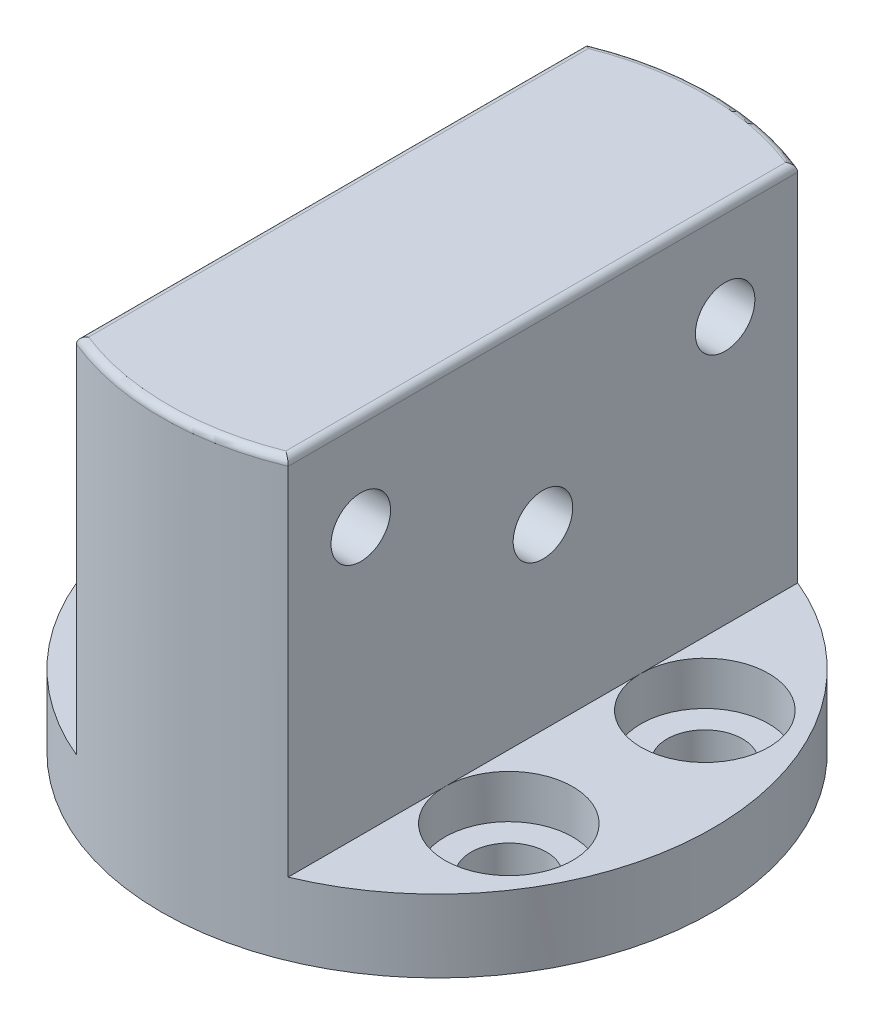
from build123d import *

# Parameters (mm, degrees)
SKETCH1_R           = 19
SKETCH1_R_2         = 2.6
BOSS_EXTRUDE1_DEPTH = 5
SKETCH2_R           = 4.4
CUT_EXTRUDE1_DEPTH  = 3
BOSS_EXTRUDE2_DEPTH = 25
FILLET1_R           = 0.5
SKETCH4_R           = 2.05
CUT_EXTRUDE2_DEPTH  = 45.184100423


with BuildPart() as part:
    # Sketch1 → Boss-Extrude1 (new body)
    with BuildSketch(Plane(origin=(0, 0, 0), x_dir=(1, 0, 0), z_dir=(0, 1, 0))):
        with Locations(Location((0, 0, 0), (0, 0, 270))):
            Circle(SKETCH1_R)
        with Locations(Location((11.691342951, 6.75, 0), (0, 0, 270))):
            Circle(SKETCH1_R_2, mode=Mode.SUBTRACT)
        with Locations(Location((11.691342951, -6.75, 0), (0, 0, 270))):
            Circle(SKETCH1_R_2, mode=Mode.SUBTRACT)
        with Locations(Location((-11.691342951, -6.75, 0), (0, 0, 270))):
            Circle(SKETCH1_R_2, mode=Mode.SUBTRACT)
        with Locations(Location((-11.691342951, 6.75, 0), (0, 0, 270))):
            Circle(SKETCH1_R_2, mode=Mode.SUBTRACT)
    extrude(amount=BOSS_EXTRUDE1_DEPTH)

    # Sketch2 → Cut-Extrude1 (cut)
    with BuildSketch(Plane(origin=(0, 5, 0), x_dir=(1, 0, 0), z_dir=(0, 1, 0))):
        with Locations(Location((-11.691342951, 6.75, 0), (0, 0, 270))):
            Circle(SKETCH2_R)
        with Locations(Location((11.691342951, 6.75, 0), (0, 0, 270))):
            Circle(SKETCH2_R)
        with Locations(Location((11.691342951, -6.75, 0), (0, 0, 270))):
            Circle(SKETCH2_R)
        with Locations(Location((-11.691342951, -6.75, 0), (0, 0, 270))):
            Circle(SKETCH2_R)
    extrude(amount=-CUT_EXTRUDE1_DEPTH, mode=Mode.SUBTRACT)

    # Sketch3 → Boss-Extrude2 (add)
    with BuildSketch(Plane(origin=(0, 5, 0), x_dir=(1, 0, 0), z_dir=(0, 1, 0))):
        with BuildLine():
            Line((-7.291342951, 17.54526483), (-7.291342951, -17.54526483))
            ThreePointArc((-7.291342951, -17.54526483), (0, -19), (7.291342951, -17.54526483))
            Line((7.291342951, -17.54526483), (7.291342951, 17.54526483))
            ThreePointArc((7.291342951, 17.54526483), (0, 19), (-7.291342951, 17.54526483))
        make_face()
    extrude(amount=BOSS_EXTRUDE2_DEPTH)

    # Fillet1
    fillet1_edges = [part.edges().sort_by_distance(p)[0] for p in [
        (0, 30, -19),
        (-7.291342951, 30, 0),
        (0, 30, 19),
        (7.291342951, 30, 0),
    ]]
    fillet(fillet1_edges, radius=FILLET1_R)

    # Sketch4 → Cut-Extrude2 (cut, through all)
    with BuildSketch(Plane(origin=(7.291342951, 0, 0), x_dir=(0, 0, -1), z_dir=(1, 0, 0))):
        with Locations((-12.54526483, 23.375)):
            Circle(SKETCH4_R)
        with Locations((12.54526483, 23.375)):
            Circle(SKETCH4_R)
        with Locations((0, 17.25)):
            Circle(SKETCH4_R)
    extrude(amount=-CUT_EXTRUDE2_DEPTH, mode=Mode.SUBTRACT)


solid = part.part
